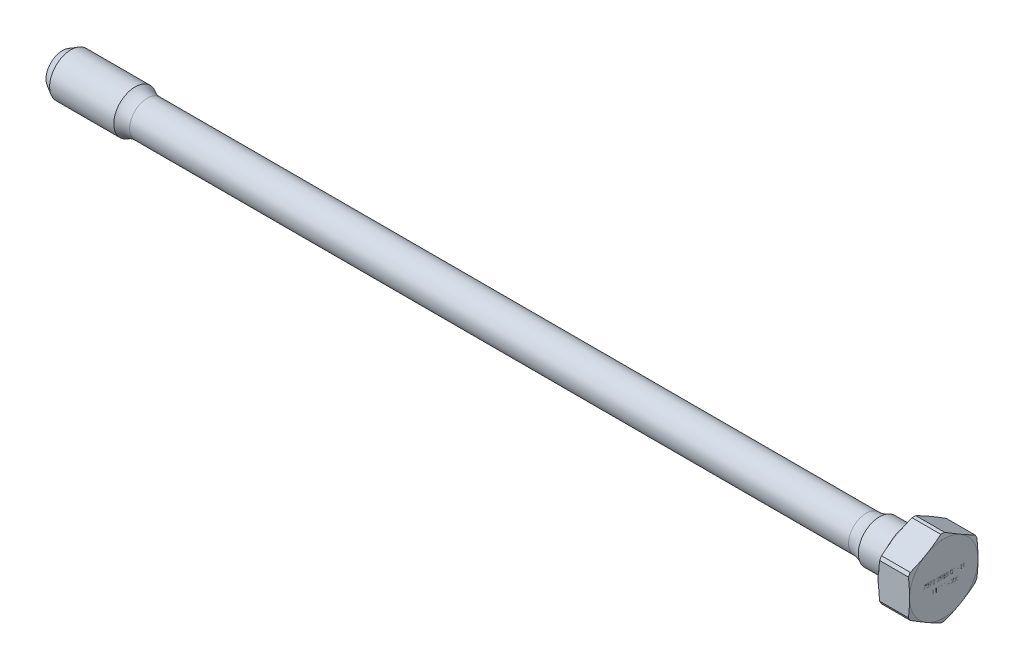
from build123d import *

# Parameters (mm, degrees)
CUT_EXTRUDE_THIN1_REACH = 414.786
SKETCH4_W               = 0.692307692
SKETCH4_H               = 0.184615385
CUT_EXTRUDE1_DEPTH      = 0.01


with BuildPart() as part:
    # Sketch1 → Revolve1 (revolve)
    with BuildSketch(Plane.XY):
        with BuildLine():
            Line((8, 0), (6.798278762, 2))
            Line((6.798278762, 2), (3.464101615, 2))
            Line((3.464101615, 2), (0, 4))
            Line((0, 4), (0, 7.690598923))
            Line((0, 7.690598923), (4, 10))
            Line((4, 10), (34, 10))
            ThreePointArc((34, 10), (36.693287386, 8.697513413), (39.651327278, 8.25))
            Line((39.651327278, 8.25), (375.706352409, 8.25))
            ThreePointArc((375.706352409, 8.25), (378.965953612, 8.682481614), (382, 9.95))
            Line((382, 9.95), (395, 9.95))
            ThreePointArc((395, 9.95), (396.414213562, 10.535786438), (397, 11.95))
            Line((397, 11.95), (397, 15.75))
            Line((397, 15.75), (397.5, 15.75))
            Line((397.5, 15.75), (397.5, 16))
            Line((397.5, 16), (398.035898385, 18))
            Line((398.035898385, 18), (411.464101615, 18))
            Line((411.464101615, 18), (412, 16))
            Line((412, 16), (412, 0))
            Line((412, 0), (8, 0))
        make_face()
    revolve(axis=Axis((412, 0, 0), (-1, 0, 0)))

    # Cut-Extrude-Thin1: up to this cone (the profile starts inside it)
    cut_extrude_thin1_end = Plane(origin=(412, 0, 0), z_dir=(1, 0, 0)).offset(-18.787186079) * Cone(3.732e-06, 1881.654948142, 504.187922789, align=(Align.CENTER, Align.CENTER, Align.MIN), mode=Mode.PRIVATE)
    # Sketch3 → Cut-Extrude-Thin1 (cut, up to the surface)
    with BuildSketch(Plane(origin=(412, 0, 0), x_dir=(0, 0, -1), z_dir=(1, 0, 0)), mode=Mode.PRIVATE) as cut_extrude_thin1_sk1:
        Polygon((0, 30.022213998), (-26, 15.011106999), (-26, -15.011106999), (0, -30.022213998), (26, -15.011106999), (26, 15.011106999), align=None)
        Polygon((0, 18.475208614), (-16, 9.237604307), (-16, -9.237604307), (0, -18.475208614), (16, -9.237604307), (16, 9.237604307), align=None, mode=Mode.SUBTRACT)
    cut_extrude_thin1_tool1 = extrude(cut_extrude_thin1_sk1.sketch, amount=-CUT_EXTRUDE_THIN1_REACH, mode=Mode.PRIVATE) & cut_extrude_thin1_end
    add(cut_extrude_thin1_tool1.solids().sort_by_distance((412, 21.828765, 12.602843))[0], mode=Mode.SUBTRACT)

    # Sketch4 → Cut-Extrude1 (cut)
    # profile 1 of 20: a face of its own
    with BuildSketch(Plane(origin=(412, 0, 0), x_dir=(0, 0, -1), z_dir=(-1, 0, 0))):
        Polygon((-9.32970633, -1.8), (-8.222014022, -1.8), (-9.168167868, 0.046153846), (-9.307711137, -0.030649038), (-8.495691907, -1.615384615), (-9.32970633, -1.615384615), align=None)
    # profile 2 of 20: a face of its own
    with BuildSketch(Plane(origin=(412, 0, 0), x_dir=(0, 0, -1), z_dir=(-1, 0, 0))):
        with BuildLine():
            Line((-7.82970633, -1.384615385), (-7.991244791, -1.384615385))
            add(Edge.make_bspline(
                [(-7.991244791, -1.384615385), (-7.986868451, -1.402734948), (-7.978313063, -1.438157212), (-7.960468597, -1.48876666), (-7.94102898, -1.536658757), (-7.917686012, -1.580936738), (-7.892224367, -1.622490459), (-7.863052682, -1.660377437), (-7.831516824, -1.695561248), (-7.796635422, -1.726785199), (-7.760054967, -1.75505946), (-7.72126002, -1.779166632), (-7.681031103, -1.799904768), (-7.639089492, -1.816989458), (-7.595310318, -1.829859728), (-7.550089369, -1.839197514), (-7.50330814, -1.845261515), (-7.471552236, -1.845853336), (-7.455427483, -1.846153846)],
                knots=[0, 0, 0, 0, 1.162005537, 2.271625781, 3.343758855, 4.383309926, 5.390229558, 6.379919256, 7.361854164, 8.333198761, 9.295911338, 10.242430842, 11.177959212, 12.116337295, 13.062827104, 14.020064771, 14.994644689, 16, 16, 16, 16], degree=3))
            add(Edge.make_bspline(
                [(-7.455427483, -1.846153846), (-7.431933502, -1.845444528), (-7.38545801, -1.844041363), (-7.317179872, -1.831228224), (-7.251337508, -1.810952442), (-7.188651609, -1.782937382), (-7.130424987, -1.748383907), (-7.078617805, -1.707259185), (-7.033932285, -1.660356687), (-6.996443748, -1.608551369), (-6.967090891, -1.553185678), (-6.945446471, -1.49620274), (-6.932269606, -1.437737726), (-6.930561891, -1.398262554), (-6.92970633, -1.378485577)],
                knots=[0, 0, 0, 0, 1.083050992, 2.142477498, 3.193116406, 4.255571735, 5.30263384, 6.308962982, 7.297363603, 8.282367274, 9.249857812, 10.179914175, 11.08814088, 12, 12, 12, 12], degree=3))
            add(Edge.make_bspline(
                [(-6.92970633, -1.378485577), (-6.930304748, -1.359453511), (-6.93147576, -1.322210712), (-6.941418808, -1.267839656), (-6.958151743, -1.216595404), (-6.981330478, -1.168262235), (-7.011334704, -1.123146603), (-7.047680663, -1.081147002), (-7.090624889, -1.04207715), (-7.123168342, -1.019695706), (-7.139922676, -1.008173077)],
                knots=[0, 0, 0, 0, 1.024540389, 2.004866551, 2.965041327, 3.920577974, 4.882998113, 5.874504559, 6.905732034, 8, 8, 8, 8], degree=3))
            add(Edge.make_bspline(
                [(-7.139922676, -1.008173077), (-7.12075051, -0.998960678), (-7.082703343, -0.980678671), (-7.031366612, -0.944255178), (-6.984053104, -0.903233283), (-6.957977388, -0.87086293), (-6.94485056, -0.854567308)],
                knots=[0, 0, 0, 0, 1.015663554, 2.015584519, 3.001021554, 4, 4, 4, 4], degree=3))
            add(Edge.make_bspline(
                [(-6.94485056, -0.854567308), (-6.936185773, -0.842710299), (-6.91899809, -0.819190449), (-6.897842752, -0.781353253), (-6.878431303, -0.743221934), (-6.864145038, -0.703297217), (-6.851816558, -0.662861556), (-6.843704829, -0.62104906), (-6.838497423, -0.578256985), (-6.837766197, -0.549294108), (-6.837398637, -0.534735577)],
                knots=[0, 0, 0, 0, 1.02516404, 2.033540309, 3.025129118, 4.011046665, 4.991655828, 5.976607087, 6.982917762, 8, 8, 8, 8], degree=3))
            add(Edge.make_bspline(
                [(-6.837398637, -0.534735577), (-6.838323695, -0.509531709), (-6.840169456, -0.459242583), (-6.856596222, -0.384924326), (-6.8822199, -0.312412067), (-6.917930742, -0.242734167), (-6.962313913, -0.177740147), (-7.014825242, -0.119420782), (-7.075520642, -0.069748369), (-7.142632925, -0.027877619), (-7.215623678, 0.005304479), (-7.293382827, 0.02921487), (-7.375449985, 0.043557751), (-7.431572003, 0.045278628), (-7.460114983, 0.046153846)],
                knots=[0, 0, 0, 0, 0.955619592, 1.906742024, 2.874954321, 3.868585453, 4.869520953, 5.854611167, 6.836527075, 7.836578462, 8.849204403, 9.870874567, 10.917152508, 12, 12, 12, 12], degree=3))
            add(Edge.make_bspline(
                [(-7.460114983, 0.046153846), (-7.479357984, 0.045703442), (-7.517221791, 0.044817197), (-7.572907128, 0.038866523), (-7.625948748, 0.027702625), (-7.676861708, 0.013662478), (-7.724877606, -0.005749598), (-7.770687107, -0.02889239), (-7.814089411, -0.056359362), (-7.854826767, -0.088196708), (-7.892855652, -0.123833855), (-7.927207215, -0.163862837), (-7.958261521, -0.207536574), (-7.985821254, -0.255247918), (-8.010002403, -0.306863238), (-8.030284587, -0.362589364), (-8.047993439, -0.421994283), (-8.056242957, -0.463380989), (-8.06047556, -0.484615385)],
                knots=[0, 0, 0, 0, 1.048603596, 2.063302207, 3.045874044, 3.999447474, 4.937100059, 5.862643889, 6.7929026, 7.7308982, 8.676022965, 9.627908155, 10.600123445, 11.591992905, 12.626222643, 13.701663232, 14.820785756, 16, 16, 16, 16], degree=3))
            Line((-8.06047556, -0.484615385), (-7.898937099, -0.484615385))
            add(Edge.make_bspline(
                [(-7.898937099, -0.484615385), (-7.894728549, -0.470755892), (-7.886542554, -0.443797975), (-7.872608343, -0.405000104), (-7.856733232, -0.369433105), (-7.839702888, -0.336836071), (-7.82181683, -0.306887978), (-7.80180344, -0.280380731), (-7.781145022, -0.256150056), (-7.765572783, -0.242498541), (-7.757951522, -0.235817308)],
                knots=[0, 0, 0, 0, 1.198163088, 2.33053128, 3.407730985, 4.417276592, 5.372219308, 6.28897303, 7.162600585, 8, 8, 8, 8], degree=3))
            add(Edge.make_bspline(
                [(-7.757951522, -0.235817308), (-7.747872157, -0.228050511), (-7.72774454, -0.212540893), (-7.694966343, -0.192691971), (-7.660373111, -0.175701768), (-7.623676359, -0.161891419), (-7.584871166, -0.151524873), (-7.54411494, -0.144063521), (-7.501340813, -0.139137869), (-7.472148306, -0.13869027), (-7.457230368, -0.138461538)],
                knots=[0, 0, 0, 0, 0.946083416, 1.889246487, 2.84504177, 3.809995578, 4.801312957, 5.829064617, 6.89060985, 8, 8, 8, 8], degree=3))
            add(Edge.make_bspline(
                [(-7.457230368, -0.138461538), (-7.440385482, -0.138777775), (-7.40744676, -0.139396147), (-7.359387447, -0.145099422), (-7.313652234, -0.153369348), (-7.27070785, -0.16630512), (-7.229969927, -0.181823716), (-7.192347853, -0.202140407), (-7.156735586, -0.225084824), (-7.1241764, -0.251773594), (-7.094822702, -0.280621266), (-7.069457863, -0.311226074), (-7.047489012, -0.342639072), (-7.029829722, -0.37559306), (-7.015860395, -0.409764787), (-7.006356401, -0.445282157), (-6.99974661, -0.481846093), (-6.999208412, -0.506701041), (-6.998937099, -0.519230769)],
                knots=[0, 0, 0, 0, 1.216990249, 2.379719373, 3.493992396, 4.571561497, 5.616923107, 6.638958652, 7.655775068, 8.674704564, 9.676001865, 10.625896028, 11.54399481, 12.441854662, 13.322657739, 14.20572845, 15.095482574, 16, 16, 16, 16], degree=3))
            add(Edge.make_bspline(
                [(-6.998937099, -0.519230769), (-6.999725753, -0.536001261), (-7.001299138, -0.569458797), (-7.013261811, -0.618700762), (-7.033114676, -0.666163542), (-7.060367437, -0.711225572), (-7.094337531, -0.752500767), (-7.133419192, -0.789446516), (-7.1784463, -0.820209536), (-7.220123847, -0.841404855), (-7.257136426, -0.855526459), (-7.288747047, -0.865428966), (-7.324167731, -0.873344661), (-7.362972872, -0.88100159), (-7.40532625, -0.887420655), (-7.451265986, -0.892796879), (-7.500810574, -0.897091944), (-7.535108819, -0.899011053), (-7.552783253, -0.9)],
                knots=[0, 0, 0, 0, 1.070440979, 2.135555593, 3.216243406, 4.345886539, 5.486149072, 6.621334998, 7.769144672, 8.957074012, 9.598644492, 10.297969361, 11.070758978, 11.915404831, 12.824182859, 13.805940418, 14.869366021, 16, 16, 16, 16], degree=3))
            Line((-7.552783253, -0.9), (-7.552783253, -1.084615385))
            add(Edge.make_bspline(
                [(-7.552783253, -1.084615385), (-7.530522743, -1.085049391), (-7.48693512, -1.085899206), (-7.423085767, -1.094060967), (-7.36221738, -1.107308659), (-7.305245511, -1.125804157), (-7.253586286, -1.148320964), (-7.208340136, -1.173531186), (-7.1711348, -1.20261518), (-7.141303929, -1.234198105), (-7.119178047, -1.268286621), (-7.102846029, -1.303654314), (-7.093185984, -1.340959147), (-7.091894134, -1.366412644), (-7.091244791, -1.379206731)],
                knots=[0, 0, 0, 0, 1.321816535, 2.58820849, 3.816448615, 5.017641336, 6.139869627, 7.160068286, 8.085608132, 8.934319198, 9.728416342, 10.48890201, 11.240453369, 12, 12, 12, 12], degree=3))
            add(Edge.make_bspline(
                [(-7.091244791, -1.379206731), (-7.091453228, -1.388608301), (-7.091867902, -1.407312278), (-7.097306347, -1.434723705), (-7.105101038, -1.461297531), (-7.116425146, -1.486723259), (-7.131070659, -1.511081715), (-7.14878955, -1.534461865), (-7.169626702, -1.557086967), (-7.193446803, -1.578458027), (-7.220030646, -1.597692359), (-7.248311259, -1.614839498), (-7.278398897, -1.629257801), (-7.310097487, -1.641209595), (-7.343578376, -1.650184395), (-7.378665427, -1.656632593), (-7.415430769, -1.660663055), (-7.44051334, -1.661243429), (-7.453264022, -1.661538462)],
                knots=[0, 0, 0, 0, 0.884246871, 1.759167212, 2.622361933, 3.489113179, 4.372562419, 5.294145153, 6.247651513, 7.265905295, 8.30305477, 9.334068495, 10.37719476, 11.441246459, 12.52060732, 13.637552802, 14.799054011, 16, 16, 16, 16], degree=3))
            add(Edge.make_bspline(
                [(-7.453264022, -1.661538462), (-7.473759843, -1.660824292), (-7.513792948, -1.659429353), (-7.57149404, -1.647168464), (-7.625079643, -1.627742351), (-7.665901063, -1.604285376), (-7.696096189, -1.581209997), (-7.718087031, -1.561358249), (-7.739288456, -1.538850432), (-7.7588685, -1.513069183), (-7.778000441, -1.484901015), (-7.796501597, -1.454190787), (-7.813777711, -1.420500664), (-7.824293964, -1.396808798), (-7.82970633, -1.384615385)],
                knots=[0, 0, 0, 0, 1.4727372, 2.876598283, 4.222346151, 5.558423782, 6.24313385, 6.953189256, 7.68715613, 8.463578749, 9.278833271, 10.135787152, 11.040551781, 12, 12, 12, 12], degree=3))
        make_face()
    # profile 3 of 20: a face of its own
    with BuildSketch(Plane(origin=(412, 0, 0), x_dir=(0, 0, -1), z_dir=(-1, 0, 0))):
        Polygon((-6.56047556, -1.8), (-5.452783253, -1.8), (-6.398937099, 0.046153846), (-6.538480368, -0.030649038), (-5.726461137, -1.615384615), (-6.56047556, -1.615384615), align=None)
    # profile 4 of 20: a face of its own
    with BuildSketch(Plane(origin=(412, 0, 0), x_dir=(0, 0, -1), z_dir=(-1, 0, 0))):
        with BuildLine():
            Line((-5.06047556, -1.246153846), (-5.222014022, -1.246153846))
            add(Edge.make_bspline(
                [(-5.222014022, -1.246153846), (-5.22096138, -1.267584694), (-5.218894018, -1.309674309), (-5.209208362, -1.371039395), (-5.195362231, -1.429701558), (-5.175739033, -1.48515788), (-5.151506099, -1.538070831), (-5.121837975, -1.58773779), (-5.087367137, -1.634651694), (-5.048156823, -1.677924309), (-5.005610019, -1.717480889), (-4.959981646, -1.752001503), (-4.911740677, -1.780834341), (-4.861305535, -1.805069006), (-4.808092921, -1.823237977), (-4.752611489, -1.836724977), (-4.694610468, -1.844838094), (-4.655092787, -1.845710272), (-4.634994791, -1.846153846)],
                knots=[0, 0, 0, 0, 1.100776268, 2.161895295, 3.184016182, 4.190939212, 5.176500551, 6.166955529, 7.155448256, 8.160289653, 9.16017456, 10.133824356, 11.091467644, 12.04088621, 13.000931625, 13.972173743, 14.968683325, 16, 16, 16, 16], degree=3))
            add(Edge.make_bspline(
                [(-4.634994791, -1.846153846), (-4.615256107, -1.845695533), (-4.576470298, -1.844794963), (-4.519886625, -1.836944817), (-4.465892231, -1.824915168), (-4.415099034, -1.807089124), (-4.366985752, -1.784721338), (-4.322148108, -1.756904065), (-4.27950188, -1.724953525), (-4.241140072, -1.687266297), (-4.205900124, -1.64705393), (-4.175525418, -1.604107459), (-4.149366483, -1.559699486), (-4.127956212, -1.51348312), (-4.111726274, -1.465307858), (-4.099701446, -1.415635572), (-4.092827404, -1.363893011), (-4.091778209, -1.328865775), (-4.091244791, -1.311057692)],
                knots=[0, 0, 0, 0, 1.111674182, 2.184400057, 3.212814286, 4.223731311, 5.211378316, 6.196328225, 7.191884489, 8.207283132, 9.220262353, 10.201199469, 11.166417575, 12.120932471, 13.06540007, 14.026332106, 14.996573967, 16, 16, 16, 16], degree=3))
            add(Edge.make_bspline(
                [(-4.091244791, -1.311057692), (-4.092117102, -1.285987963), (-4.093846417, -1.236288443), (-4.108591968, -1.163243641), (-4.131722768, -1.092563643), (-4.15923882, -1.035458466), (-4.186892336, -0.989394593), (-4.212465652, -0.951822035), (-4.242001176, -0.911145427), (-4.275933882, -0.867408528), (-4.314776321, -0.821169673), (-4.35704678, -0.771186594), (-4.40461038, -0.719039074), (-4.437845368, -0.683380978), (-4.455066907, -0.664903846)],
                knots=[0, 0, 0, 0, 1.184219417, 2.34765746, 3.508456027, 4.692825395, 5.335023057, 6.047372803, 6.840716919, 7.711366838, 8.663720231, 9.695456184, 10.805843131, 12, 12, 12, 12], degree=3))
            Line((-4.455066907, -0.664903846), (-4.905427483, -0.184615385))
            Line((-4.905427483, -0.184615385), (-4.068167868, -0.184615385))
            Line((-4.068167868, -0.184615385), (-4.068167868, 0))
            Line((-4.068167868, 0), (-5.291244791, 0))
            Line((-5.291244791, 0), (-4.593167868, -0.744951923))
            add(Edge.make_bspline(
                [(-4.593167868, -0.744951923), (-4.576170609, -0.762692942), (-4.543522352, -0.796769807), (-4.497364287, -0.846536061), (-4.455840236, -0.892650691), (-4.418922655, -0.935318042), (-4.386581169, -0.97429623), (-4.358919255, -1.009890718), (-4.335814653, -1.041796045), (-4.311328589, -1.079277089), (-4.287979502, -1.125093533), (-4.267458044, -1.180801987), (-4.255034633, -1.238276292), (-4.253536717, -1.277103964), (-4.252783253, -1.296634615)],
                knots=[0, 0, 0, 0, 1.329530082, 2.553755191, 3.672934919, 4.687409497, 5.60679272, 6.413407421, 7.126401618, 7.737995624, 8.834647426, 9.90044882, 10.943907757, 12, 12, 12, 12], degree=3))
            add(Edge.make_bspline(
                [(-4.252783253, -1.296634615), (-4.253106847, -1.308917835), (-4.253744591, -1.333125701), (-4.259479594, -1.368594904), (-4.267905453, -1.402941748), (-4.280892304, -1.43574156), (-4.296495527, -1.467639448), (-4.316429795, -1.497665618), (-4.339209429, -1.526843589), (-4.365632687, -1.554172872), (-4.394640515, -1.57921074), (-4.425289982, -1.601388366), (-4.45771549, -1.61992289), (-4.491781908, -1.635116655), (-4.527393845, -1.647035431), (-4.56462029, -1.655294127), (-4.603358354, -1.660479405), (-4.629809867, -1.661180979), (-4.64328806, -1.661538462)],
                knots=[0, 0, 0, 0, 0.991504627, 1.954065223, 2.895985987, 3.842598665, 4.797835564, 5.759220273, 6.74786863, 7.784730864, 8.824135544, 9.839918996, 10.835834653, 11.835434876, 12.84861661, 13.863796685, 14.911511676, 16, 16, 16, 16], degree=3))
            add(Edge.make_bspline(
                [(-4.64328806, -1.661538462), (-4.657368084, -1.661185352), (-4.685018927, -1.660491904), (-4.725529246, -1.65523614), (-4.764445256, -1.647276553), (-4.801167273, -1.634604956), (-4.836463824, -1.619774507), (-4.869434475, -1.600571685), (-4.901005414, -1.57862949), (-4.930541896, -1.553046285), (-4.957443249, -1.5241667), (-4.981915651, -1.492731782), (-5.00265136, -1.458184254), (-5.021058239, -1.421353093), (-5.035135868, -1.381226396), (-5.047171231, -1.338785509), (-5.055913545, -1.293424902), (-5.058929632, -1.262172573), (-5.06047556, -1.246153846)],
                knots=[0, 0, 0, 0, 1.031072318, 2.024855787, 2.988461151, 3.935103592, 4.865765533, 5.788564469, 6.724086513, 7.67908574, 8.64457978, 9.611397706, 10.591395687, 11.591555111, 12.622101007, 13.700900657, 14.821571223, 16, 16, 16, 16], degree=3))
        make_face()
    # profile 5 of 20: a face of its own
    with BuildSketch(Plane(origin=(412, 0, 0), x_dir=(0, 0, -1), z_dir=(-1, 0, 0))):
        with BuildLine():
            Line((-2.983552483, -1.246153846), (-3.145090945, -1.246153846))
            add(Edge.make_bspline(
                [(-3.145090945, -1.246153846), (-3.144038303, -1.267584694), (-3.141970941, -1.309674309), (-3.132285285, -1.371039395), (-3.118439154, -1.429701558), (-3.098815957, -1.48515788), (-3.074583022, -1.538070831), (-3.044914898, -1.58773779), (-3.01044406, -1.634651694), (-2.971233746, -1.677924309), (-2.928686942, -1.717480889), (-2.883058569, -1.752001503), (-2.8348176, -1.780834341), (-2.784382458, -1.805069006), (-2.731169844, -1.823237977), (-2.675688412, -1.836724977), (-2.617687391, -1.844838094), (-2.57816971, -1.845710272), (-2.558071714, -1.846153846)],
                knots=[0, 0, 0, 0, 1.100776268, 2.161895295, 3.184016182, 4.190939212, 5.176500551, 6.166955529, 7.155448256, 8.160289653, 9.16017456, 10.133824356, 11.091467644, 12.04088621, 13.000931625, 13.972173743, 14.968683325, 16, 16, 16, 16], degree=3))
            add(Edge.make_bspline(
                [(-2.558071714, -1.846153846), (-2.53833303, -1.845695533), (-2.499547221, -1.844794963), (-2.442963548, -1.836944817), (-2.388969154, -1.824915168), (-2.338175957, -1.807089124), (-2.290062675, -1.784721338), (-2.245225031, -1.756904065), (-2.202578803, -1.724953525), (-2.164216995, -1.687266297), (-2.128977047, -1.64705393), (-2.098602341, -1.604107459), (-2.072443406, -1.559699486), (-2.051033135, -1.51348312), (-2.034803198, -1.465307858), (-2.022778369, -1.415635572), (-2.015904327, -1.363893011), (-2.014855132, -1.328865775), (-2.014321714, -1.311057692)],
                knots=[0, 0, 0, 0, 1.111674182, 2.184400057, 3.212814286, 4.223731311, 5.211378316, 6.196328225, 7.191884489, 8.207283132, 9.220262353, 10.201199469, 11.166417575, 12.120932471, 13.06540007, 14.026332106, 14.996573967, 16, 16, 16, 16], degree=3))
            add(Edge.make_bspline(
                [(-2.014321714, -1.311057692), (-2.015194025, -1.285987963), (-2.01692334, -1.236288443), (-2.031668891, -1.163243641), (-2.054799691, -1.092563643), (-2.082315743, -1.035458466), (-2.109969259, -0.989394593), (-2.135542575, -0.951822035), (-2.165078099, -0.911145427), (-2.199010805, -0.867408528), (-2.237853244, -0.821169673), (-2.280123703, -0.771186594), (-2.327687303, -0.719039074), (-2.360922291, -0.683380978), (-2.37814383, -0.664903846)],
                knots=[0, 0, 0, 0, 1.184219417, 2.34765746, 3.508456027, 4.692825395, 5.335023057, 6.047372803, 6.840716919, 7.711366838, 8.663720231, 9.695456184, 10.805843131, 12, 12, 12, 12], degree=3))
            Line((-2.37814383, -0.664903846), (-2.828504407, -0.184615385))
            Line((-2.828504407, -0.184615385), (-1.991244791, -0.184615385))
            Line((-1.991244791, -0.184615385), (-1.991244791, 0))
            Line((-1.991244791, 0), (-3.214321714, 0))
            Line((-3.214321714, 0), (-2.516244791, -0.744951923))
            add(Edge.make_bspline(
                [(-2.516244791, -0.744951923), (-2.499247532, -0.762692942), (-2.466599275, -0.796769807), (-2.42044121, -0.846536061), (-2.378917159, -0.892650691), (-2.341999579, -0.935318042), (-2.309658092, -0.97429623), (-2.281996178, -1.009890718), (-2.258891576, -1.041796045), (-2.234405512, -1.079277089), (-2.211056425, -1.125093533), (-2.190534968, -1.180801987), (-2.178111556, -1.238276292), (-2.17661364, -1.277103964), (-2.175860176, -1.296634615)],
                knots=[0, 0, 0, 0, 1.329530082, 2.553755191, 3.672934919, 4.687409497, 5.60679272, 6.413407421, 7.126401618, 7.737995624, 8.834647426, 9.90044882, 10.943907757, 12, 12, 12, 12], degree=3))
            add(Edge.make_bspline(
                [(-2.175860176, -1.296634615), (-2.176183771, -1.308917835), (-2.176821514, -1.333125701), (-2.182556517, -1.368594904), (-2.190982376, -1.402941748), (-2.203969227, -1.43574156), (-2.21957245, -1.467639448), (-2.239506718, -1.497665618), (-2.262286352, -1.526843589), (-2.288709611, -1.554172872), (-2.317717438, -1.57921074), (-2.348366905, -1.601388366), (-2.380792413, -1.61992289), (-2.414858831, -1.635116655), (-2.450470768, -1.647035431), (-2.487697213, -1.655294127), (-2.526435277, -1.660479405), (-2.55288679, -1.661180979), (-2.566364983, -1.661538462)],
                knots=[0, 0, 0, 0, 0.991504627, 1.954065223, 2.895985987, 3.842598665, 4.797835564, 5.759220273, 6.74786863, 7.784730864, 8.824135544, 9.839918996, 10.835834653, 11.835434876, 12.84861661, 13.863796685, 14.911511676, 16, 16, 16, 16], degree=3))
            add(Edge.make_bspline(
                [(-2.566364983, -1.661538462), (-2.580445007, -1.661185352), (-2.60809585, -1.660491904), (-2.648606169, -1.65523614), (-2.687522179, -1.647276553), (-2.724244196, -1.634604956), (-2.759540747, -1.619774507), (-2.792511398, -1.600571685), (-2.824082337, -1.57862949), (-2.853618819, -1.553046285), (-2.880520172, -1.5241667), (-2.904992574, -1.492731782), (-2.925728283, -1.458184254), (-2.944135162, -1.421353093), (-2.958212791, -1.381226396), (-2.970248155, -1.338785509), (-2.978990468, -1.293424902), (-2.982006555, -1.262172573), (-2.983552483, -1.246153846)],
                knots=[0, 0, 0, 0, 1.031072318, 2.024855787, 2.988461151, 3.935103592, 4.865765533, 5.788564469, 6.724086513, 7.67908574, 8.64457978, 9.611397706, 10.591395687, 11.591555111, 12.622101007, 13.700900657, 14.821571223, 16, 16, 16, 16], degree=3))
        make_face()
    # profile 6 of 20: a face of its own
    with BuildSketch(Plane(origin=(412, 0, 0), x_dir=(0, 0, -1), z_dir=(-1, 0, 0))):
        with BuildLine():
            Line((-1.437398637, 0.046153846), (-1.566485176, -0.043629808))
            Line((-1.566485176, -0.043629808), (-1.066004407, -0.775240385))
            add(Edge.make_bspline(
                [(-1.066004407, -0.775240385), (-1.09793237, -0.771153166), (-1.160783618, -0.763107343), (-1.224136969, -0.762055819), (-1.255307291, -0.761538462)],
                knots=[0, 0, 0, 0, 1.015985029, 2, 2, 2, 2], degree=3))
            add(Edge.make_bspline(
                [(-1.255307291, -0.761538462), (-1.274202679, -0.762023879), (-1.311292672, -0.762976711), (-1.365830671, -0.770486371), (-1.418312822, -0.782183545), (-1.468539233, -0.799232971), (-1.516465114, -0.821022604), (-1.562257879, -0.847565152), (-1.605856235, -0.878959722), (-1.646749663, -0.914867688), (-1.683932106, -0.954306275), (-1.717085264, -0.996033311), (-1.74448788, -1.040501542), (-1.767657677, -1.086772527), (-1.784736529, -1.135834029), (-1.797473965, -1.186853523), (-1.80522998, -1.240147719), (-1.806158144, -1.276416658), (-1.806629407, -1.294831731)],
                knots=[0, 0, 0, 0, 1.060682839, 2.082027659, 3.085691555, 4.076014095, 5.054630121, 6.037449673, 7.043289733, 8.066773124, 9.088474683, 10.083546559, 11.053653938, 12.01652662, 12.983553501, 13.964076119, 14.966286614, 16, 16, 16, 16], degree=3))
            add(Edge.make_bspline(
                [(-1.806629407, -1.294831731), (-1.805735619, -1.320014638), (-1.803981295, -1.369443577), (-1.789916142, -1.441680476), (-1.76661278, -1.510021357), (-1.734630125, -1.5743898), (-1.693574589, -1.633307262), (-1.644818097, -1.686574127), (-1.587966586, -1.733240192), (-1.524504355, -1.773308501), (-1.45601339, -1.80575337), (-1.383984537, -1.828804067), (-1.309631166, -1.843529391), (-1.259101366, -1.845275255), (-1.233672676, -1.846153846)],
                knots=[0, 0, 0, 0, 1.023011052, 2.007963168, 2.978169221, 3.950402619, 4.919353283, 5.887490769, 6.876420893, 7.899700203, 8.931203047, 9.947778163, 10.96723692, 12, 12, 12, 12], degree=3))
            add(Edge.make_bspline(
                [(-1.233672676, -1.846153846), (-1.208734811, -1.845215997), (-1.15945994, -1.843362894), (-1.086904085, -1.829672294), (-1.017350207, -1.806843717), (-0.951342832, -1.775152568), (-0.890550864, -1.735165766), (-0.835645984, -1.687930006), (-0.788303075, -1.632902895), (-0.747925904, -1.571770237), (-0.716121528, -1.505675253), (-0.692816107, -1.436817008), (-0.67857054, -1.365607557), (-0.676769244, -1.31737207), (-0.675860176, -1.293028846)],
                knots=[0, 0, 0, 0, 1.026310256, 2.027892329, 3.027798401, 4.032590076, 5.033095916, 6.015299856, 7.004484051, 8.011843335, 9.023241558, 10.015317641, 10.998381257, 12, 12, 12, 12], degree=3))
            add(Edge.make_bspline(
                [(-0.675860176, -1.293028846), (-0.67646136, -1.274131201), (-0.677680711, -1.235802056), (-0.686343256, -1.177726419), (-0.700594462, -1.118433843), (-0.716868911, -1.068137572), (-0.73378425, -1.026889426), (-0.747912723, -0.993693125), (-0.765140256, -0.959286833), (-0.784746079, -0.923421742), (-0.805765141, -0.885575417), (-0.829459561, -0.846451752), (-0.855329055, -0.805829586), (-0.873756042, -0.778445554), (-0.883191907, -0.764423077)],
                knots=[0, 0, 0, 0, 1.179744101, 2.39281581, 3.657884751, 4.98449437, 5.688244212, 6.441097573, 7.23650985, 8.089392143, 8.993247458, 9.939208743, 10.944735416, 12, 12, 12, 12], degree=3))
            Line((-0.883191907, -0.764423077), (-1.437398637, 0.046153846))
        make_face()
        with BuildLine():
            add(Edge.make_bspline(
                [(-1.225379407, -0.946153846), (-1.211065114, -0.946545711), (-1.183200054, -0.947308538), (-1.142372676, -0.951930626), (-1.103857393, -0.960186275), (-1.067406317, -0.971844403), (-1.033063577, -0.986612925), (-1.000818356, -1.004610786), (-0.971000023, -1.026232281), (-0.943502421, -1.050535275), (-0.918547511, -1.077170391), (-0.897030626, -1.105707444), (-0.878400899, -1.135259887), (-0.863538541, -1.166432701), (-0.851561002, -1.198715934), (-0.843203494, -1.232576466), (-0.838587527, -1.267780508), (-0.837799234, -1.291693827), (-0.837398637, -1.303846154)],
                knots=[0, 0, 0, 0, 1.163726718, 2.265380301, 3.334713825, 4.36057981, 5.371541381, 6.368955992, 7.355979581, 8.359691305, 9.348261197, 10.317521986, 11.261029684, 12.183096459, 13.119698615, 14.055740009, 15.011961376, 16, 16, 16, 16], degree=3))
            add(Edge.make_bspline(
                [(-0.837398637, -1.303846154), (-0.837742674, -1.316003889), (-0.838420639, -1.339962198), (-0.843870782, -1.375213573), (-0.853429945, -1.409009015), (-0.866394343, -1.441569956), (-0.883117173, -1.472750864), (-0.903454544, -1.502461306), (-0.927537922, -1.53081058), (-0.954979797, -1.557443479), (-0.98509243, -1.581916363), (-1.017281877, -1.603154932), (-1.050842403, -1.621410256), (-1.086155367, -1.635702372), (-1.122741515, -1.647434514), (-1.161003244, -1.655734044), (-1.200986993, -1.660359229), (-1.22813231, -1.661140377), (-1.241965945, -1.661538462)],
                knots=[0, 0, 0, 0, 0.97180342, 1.915057841, 2.843062057, 3.774592458, 4.711855407, 5.666109401, 6.64802866, 7.681008178, 8.719604906, 9.745767187, 10.760480799, 11.768803314, 12.78696958, 13.829338598, 14.893800474, 16, 16, 16, 16], degree=3))
            add(Edge.make_bspline(
                [(-1.241965945, -1.661538462), (-1.255679303, -1.661139797), (-1.282584799, -1.660357619), (-1.322212615, -1.655742103), (-1.3602174, -1.647381136), (-1.396690639, -1.6356966), (-1.431929121, -1.621489815), (-1.465222497, -1.603155361), (-1.497076544, -1.581802986), (-1.527180474, -1.557475002), (-1.554562279, -1.530682552), (-1.579062968, -1.502587621), (-1.599353761, -1.472734857), (-1.616100165, -1.441574184), (-1.629058328, -1.409007891), (-1.638619156, -1.375213877), (-1.644068851, -1.339962119), (-1.644746878, -1.316003863), (-1.645090945, -1.303846154)],
                knots=[0, 0, 0, 0, 1.099260809, 2.156740654, 3.192227907, 4.212865946, 5.223636336, 6.232338816, 7.252976855, 8.294094955, 9.329582207, 10.320135147, 11.276705756, 12.216244072, 13.150035923, 14.080293028, 15.025837361, 16, 16, 16, 16], degree=3))
            add(Edge.make_bspline(
                [(-1.645090945, -1.303846154), (-1.644778987, -1.2916844), (-1.64416375, -1.267699195), (-1.638240048, -1.232454504), (-1.628307323, -1.198681498), (-1.615136477, -1.166091878), (-1.597460822, -1.13510727), (-1.57597979, -1.105567004), (-1.551194345, -1.076867169), (-1.522292214, -1.050618556), (-1.491256323, -1.026115962), (-1.457920471, -1.004746733), (-1.422954559, -0.986827977), (-1.386583092, -0.971800869), (-1.348533914, -0.960303872), (-1.308860009, -0.951945961), (-1.26755423, -0.947352851), (-1.239572557, -0.946557349), (-1.225379407, -0.946153846)],
                knots=[0, 0, 0, 0, 0.952872936, 1.879239831, 2.791748947, 3.708674669, 4.628500839, 5.580394867, 6.568761142, 7.595635223, 8.636123962, 9.665976811, 10.694276597, 11.712685318, 12.747011694, 13.805940053, 14.887106426, 16, 16, 16, 16], degree=3))
        make_face(mode=Mode.SUBTRACT)
    # profile 7 of 20: a face of its own
    with BuildSketch(Plane(origin=(412, 0, 0), x_dir=(0, 0, -1), z_dir=(-1, 0, 0))):
        with BuildLine():
            add(Edge.make_bspline(
                [(0.430029247, -1.002764423), (0.444645509, -0.995083435), (0.47324127, -0.980056083), (0.513977013, -0.955786441), (0.551997364, -0.931092929), (0.586599112, -0.905087716), (0.618121492, -0.878323581), (0.646661512, -0.850871346), (0.6725261, -0.822817829), (0.694826696, -0.793441829), (0.714613059, -0.763265738), (0.731374535, -0.73191764), (0.746003048, -0.699850523), (0.757484607, -0.666577542), (0.76696395, -0.632555155), (0.773481403, -0.597326838), (0.776987632, -0.561129388), (0.777650397, -0.536665662), (0.777985978, -0.524278846)],
                knots=[0, 0, 0, 0, 1.264219729, 2.473363326, 3.62979159, 4.734286947, 5.785533755, 6.79450939, 7.765315851, 8.704182021, 9.615576613, 10.525715488, 11.423813905, 12.311666436, 13.218214638, 14.126256791, 15.051260205, 16, 16, 16, 16], degree=3))
            add(Edge.make_bspline(
                [(0.777985978, -0.524278846), (0.777591471, -0.506947837), (0.776810594, -0.472643267), (0.769938273, -0.422024695), (0.759786946, -0.372664714), (0.744366108, -0.325122876), (0.725390034, -0.278994116), (0.701444738, -0.234899911), (0.674419371, -0.191574521), (0.652685296, -0.164926267), (0.641687901, -0.151442308)],
                knots=[0, 0, 0, 0, 1.02531512, 2.029483338, 3.018748588, 4.004195107, 4.983200899, 5.966616707, 6.971112471, 8, 8, 8, 8], degree=3))
            add(Edge.make_bspline(
                [(0.641687901, -0.151442308), (0.627372, -0.135708367), (0.598917103, -0.104434913), (0.550171598, -0.06383164), (0.496674629, -0.029709094), (0.438633201, -0.001900691), (0.376202463, 0.019743465), (0.309395718, 0.03529676), (0.238082725, 0.044205438), (0.189068483, 0.045493204), (0.163923478, 0.046153846)],
                knots=[0, 0, 0, 0, 0.954267603, 1.896743057, 2.838368354, 3.796610408, 4.779680527, 5.799409237, 6.871065594, 8, 8, 8, 8], degree=3))
            add(Edge.make_bspline(
                [(0.163923478, 0.046153846), (0.139745721, 0.045559553), (0.092698261, 0.044403118), (0.024209401, 0.036610737), (-0.039710482, 0.022815243), (-0.099364447, 0.004323735), (-0.154175657, -0.020335131), (-0.204243771, -0.050559702), (-0.250302627, -0.085667608), (-0.290907303, -0.126503758), (-0.326946192, -0.170251732), (-0.358631446, -0.215371227), (-0.384819209, -0.261829401), (-0.407390958, -0.308919579), (-0.424188719, -0.357595908), (-0.436102801, -0.407358856), (-0.443586506, -0.458067053), (-0.444587414, -0.492282353), (-0.445090945, -0.509495192)],
                knots=[0, 0, 0, 0, 1.256864279, 2.445730223, 3.576845088, 4.651810441, 5.686528262, 6.692706664, 7.686234615, 8.689148594, 9.678739427, 10.630299996, 11.55097961, 12.448208961, 13.341360817, 14.221834469, 15.105450545, 16, 16, 16, 16], degree=3))
            add(Edge.make_bspline(
                [(-0.445090945, -0.509495192), (-0.444793676, -0.522125606), (-0.444206168, -0.54708776), (-0.44014187, -0.583967254), (-0.433602191, -0.619860886), (-0.424740324, -0.654910331), (-0.412620173, -0.688930652), (-0.39824135, -0.722097296), (-0.381314025, -0.754409302), (-0.361171645, -0.785374728), (-0.338979965, -0.816090445), (-0.312636399, -0.845031275), (-0.283897258, -0.873897164), (-0.251051691, -0.900932778), (-0.215873601, -0.92837164), (-0.176722363, -0.953920345), (-0.134903441, -0.979572846), (-0.105173522, -0.994901258), (-0.089922676, -1.002764423)],
                knots=[0, 0, 0, 0, 0.941575622, 1.860885767, 2.762557628, 3.660168386, 4.552890429, 5.45184204, 6.353736508, 7.268493418, 8.204037487, 9.175167802, 10.182660057, 11.238220596, 12.344046335, 13.507168087, 14.721227736, 16, 16, 16, 16], degree=3))
            add(Edge.make_bspline(
                [(-0.089922676, -1.002764423), (-0.110772825, -1.014181083), (-0.151081421, -1.036252366), (-0.204964257, -1.07629761), (-0.250607576, -1.120454945), (-0.287526311, -1.16879082), (-0.316675522, -1.219716604), (-0.337284346, -1.272964201), (-0.350736197, -1.327939721), (-0.352098882, -1.365427568), (-0.352783253, -1.384254808)],
                knots=[0, 0, 0, 0, 1.16701039, 2.256125286, 3.287752239, 4.277689688, 5.235169525, 6.160862735, 7.076343936, 8, 8, 8, 8], degree=3))
            add(Edge.make_bspline(
                [(-0.352783253, -1.384254808), (-0.351940686, -1.403435524), (-0.350246979, -1.441992109), (-0.336598527, -1.499403172), (-0.314188491, -1.55582094), (-0.284229607, -1.611114672), (-0.246103226, -1.662764853), (-0.200975325, -1.709464051), (-0.148902672, -1.750003643), (-0.091029806, -1.784272923), (-0.028861782, -1.812297636), (0.036841653, -1.831429687), (0.104909503, -1.844012853), (0.151246339, -1.845433518), (0.174740786, -1.846153846)],
                knots=[0, 0, 0, 0, 0.888724595, 1.786491426, 2.720083884, 3.697804067, 4.69440576, 5.687697823, 6.7000873, 7.744853364, 8.800284131, 9.853047784, 10.91141782, 12, 12, 12, 12], degree=3))
            add(Edge.make_bspline(
                [(0.174740786, -1.846153846), (0.197629316, -1.845413226), (0.242762891, -1.843952809), (0.309203685, -1.831652226), (0.372829475, -1.811338567), (0.433283662, -1.78367129), (0.489279913, -1.749197053), (0.539111392, -1.708211327), (0.583184901, -1.662020971), (0.619597574, -1.610200438), (0.64880823, -1.554910393), (0.669843266, -1.497556362), (0.683141788, -1.438825933), (0.684831634, -1.399106878), (0.685678286, -1.379206731)],
                knots=[0, 0, 0, 0, 1.072634126, 2.115112298, 3.156050586, 4.19761425, 5.225177188, 6.230426315, 7.215180151, 8.209739481, 9.190420596, 10.139012357, 11.067603024, 12, 12, 12, 12], degree=3))
            add(Edge.make_bspline(
                [(0.685678286, -1.379206731), (0.684936049, -1.35967759), (0.683478337, -1.321323466), (0.67137731, -1.265492601), (0.650680797, -1.213314117), (0.622761136, -1.163985101), (0.586115943, -1.118293828), (0.541485122, -1.076013379), (0.489447807, -1.036316837), (0.450278164, -1.014198562), (0.430029247, -1.002764423)],
                knots=[0, 0, 0, 0, 0.975463758, 1.915755378, 2.838359076, 3.772025586, 4.738400888, 5.753889765, 6.838863581, 8, 8, 8, 8], degree=3))
        make_face()
        with BuildLine():
            add(Edge.make_bspline(
                [(0.165726363, -1.661538462), (0.153099793, -1.661204519), (0.128396701, -1.660551183), (0.092182422, -1.65711155), (0.057717253, -1.650504554), (0.024812725, -1.641453058), (-0.006643881, -1.630191184), (-0.035931208, -1.615353282), (-0.064033478, -1.598860891), (-0.090028769, -1.579516068), (-0.113561109, -1.558410447), (-0.134579636, -1.536368951), (-0.151703213, -1.512741806), (-0.166435254, -1.488711045), (-0.177375852, -1.463279935), (-0.185147675, -1.437005296), (-0.190647856, -1.409720707), (-0.191044266, -1.391133262), (-0.191244791, -1.381730769)],
                knots=[0, 0, 0, 0, 1.20353747, 2.354645537, 3.462130888, 4.543058862, 5.604822423, 6.639552563, 7.666902586, 8.706944258, 9.720926464, 10.677177239, 11.602682187, 12.496457588, 13.358248655, 14.231532794, 15.105417644, 16, 16, 16, 16], degree=3))
            add(Edge.make_bspline(
                [(-0.191244791, -1.381730769), (-0.19087908, -1.3723336), (-0.190156383, -1.353763444), (-0.184925476, -1.326230596), (-0.176179357, -1.299526385), (-0.164186545, -1.273401523), (-0.148796018, -1.247923065), (-0.130116513, -1.22299338), (-0.107337532, -1.199271713), (-0.082182663, -1.176085036), (-0.05470542, -1.154722807), (-0.025831837, -1.135640894), (0.004648809, -1.120428962), (0.035823693, -1.107091206), (0.06835209, -1.097086343), (0.102009714, -1.089878428), (0.136760612, -1.085419883), (0.160304511, -1.084885673), (0.172216747, -1.084615385)],
                knots=[0, 0, 0, 0, 0.873213166, 1.72559466, 2.594724523, 3.479581045, 4.391597569, 5.35687048, 6.368548091, 7.443976143, 8.534559525, 9.600545123, 10.654815915, 11.696401765, 12.749428718, 13.812189468, 14.893058657, 16, 16, 16, 16], degree=3))
            add(Edge.make_bspline(
                [(0.172216747, -1.084615385), (0.187517717, -1.085062024), (0.217968529, -1.085950891), (0.262841496, -1.094290684), (0.306582272, -1.107243171), (0.348363207, -1.125626885), (0.387436519, -1.14804105), (0.42270018, -1.174473623), (0.452678473, -1.205545353), (0.47818237, -1.239453844), (0.498122808, -1.275422562), (0.513397495, -1.311665783), (0.522392938, -1.348482042), (0.523562272, -1.373151766), (0.524139824, -1.385336538)],
                knots=[0, 0, 0, 0, 1.076561449, 2.142489767, 3.202892658, 4.283174188, 5.348766409, 6.369549039, 7.375093932, 8.378927502, 9.349008457, 10.26378795, 11.142457041, 12, 12, 12, 12], degree=3))
            add(Edge.make_bspline(
                [(0.524139824, -1.385336538), (0.523871336, -1.393889893), (0.523338427, -1.410867076), (0.518769045, -1.43601989), (0.511642206, -1.460616168), (0.501253829, -1.484511518), (0.488687128, -1.508261052), (0.472668666, -1.531119723), (0.454104182, -1.553779299), (0.432725671, -1.57549393), (0.408572364, -1.595880208), (0.381448878, -1.613551918), (0.35159457, -1.628288157), (0.319409683, -1.64066842), (0.284554092, -1.649863345), (0.247327896, -1.656782859), (0.207395201, -1.660674917), (0.179917224, -1.66124437), (0.165726363, -1.661538462)],
                knots=[0, 0, 0, 0, 0.814035228, 1.61574325, 2.427118093, 3.24780647, 4.092880925, 4.981933388, 5.900917883, 6.880367106, 7.87994501, 8.905470125, 9.95492938, 11.0455354, 12.184050453, 13.382997595, 14.64846247, 16, 16, 16, 16], degree=3))
        make_face(mode=Mode.SUBTRACT)
        with BuildLine():
            add(Edge.make_bspline(
                [(0.176183093, -0.9), (0.16017559, -0.899715189), (0.128772776, -0.899156459), (0.082765734, -0.892940153), (0.03861494, -0.884280845), (-0.003544072, -0.871165865), (-0.043494893, -0.854101493), (-0.081799758, -0.833866072), (-0.117858824, -0.809611919), (-0.151510918, -0.781927173), (-0.182320315, -0.751925879), (-0.209448418, -0.720240506), (-0.23236782, -0.6873013), (-0.250967171, -0.653066598), (-0.265396055, -0.617611832), (-0.276044795, -0.580916309), (-0.282227439, -0.542877673), (-0.283108339, -0.517089011), (-0.283552483, -0.504086538)],
                knots=[0, 0, 0, 0, 1.140332253, 2.237053636, 3.304055028, 4.344690294, 5.377465719, 6.397042765, 7.428360044, 8.469453732, 9.499453352, 10.490108612, 11.438398528, 12.354680514, 13.261581007, 14.161901135, 15.073242693, 16, 16, 16, 16], degree=3))
            add(Edge.make_bspline(
                [(-0.283552483, -0.504086538), (-0.282838423, -0.487924897), (-0.281416559, -0.455743209), (-0.270540968, -0.408301687), (-0.252680105, -0.36238672), (-0.22762342, -0.318645866), (-0.197060123, -0.277609464), (-0.159904473, -0.24133588), (-0.117062366, -0.210313411), (-0.068885768, -0.184384992), (-0.016074783, -0.163849332), (0.041044225, -0.149157469), (0.102084352, -0.139923012), (0.144178049, -0.138956373), (0.165726363, -0.138461538)],
                knots=[0, 0, 0, 0, 0.899105568, 1.790333855, 2.694925079, 3.632758987, 4.588257081, 5.534574046, 6.511571685, 7.523527334, 8.572244311, 9.657983075, 10.801090915, 12, 12, 12, 12], degree=3))
            add(Edge.make_bspline(
                [(0.165726363, -0.138461538), (0.182568241, -0.138788702), (0.215381622, -0.139426122), (0.263270566, -0.144935459), (0.308356818, -0.153934833), (0.351072321, -0.166137018), (0.391099131, -0.182312084), (0.428382693, -0.202403066), (0.463430705, -0.22535131), (0.494745284, -0.252520047), (0.523217935, -0.281592276), (0.548157733, -0.312206294), (0.569264471, -0.344055499), (0.58627853, -0.377121248), (0.599789318, -0.411282028), (0.609529058, -0.446678068), (0.615531934, -0.4834484), (0.61613953, -0.508390595), (0.616447517, -0.521033654)],
                knots=[0, 0, 0, 0, 1.224631902, 2.385975653, 3.500340538, 4.565441647, 5.612488581, 6.63322211, 7.641830068, 8.652595074, 9.641693811, 10.598750962, 11.520088299, 12.415429315, 13.298523938, 14.187139574, 15.081071174, 16, 16, 16, 16], degree=3))
            add(Edge.make_bspline(
                [(0.616447517, -0.521033654), (0.615984729, -0.533314827), (0.615072194, -0.557531156), (0.609197257, -0.593390805), (0.599111933, -0.628177702), (0.58440583, -0.66173495), (0.566345989, -0.694452907), (0.544036322, -0.726056901), (0.517748741, -0.756634442), (0.487547587, -0.785555972), (0.454816357, -0.812292614), (0.420128399, -0.836052884), (0.383325631, -0.855472371), (0.345137099, -0.871786107), (0.30517783, -0.884499506), (0.26364056, -0.893414308), (0.220446601, -0.899017255), (0.191104285, -0.899668718), (0.176183093, -0.9)],
                knots=[0, 0, 0, 0, 0.917336384, 1.808827106, 2.706624561, 3.615530867, 4.539869921, 5.493819324, 6.499753197, 7.547410123, 8.613069608, 9.653934021, 10.682176708, 11.716048074, 12.752411263, 13.808993382, 14.885826486, 16, 16, 16, 16], degree=3))
        make_face(mode=Mode.SUBTRACT)
    # profile 8 of 20: a face of its own
    with BuildSketch(Plane(origin=(412, 0, 0), x_dir=(0, 0, -1), z_dir=(-1, 0, 0))):
        with BuildLine():
            add(Edge.make_bspline(
                [(1.814644632, -1.002764423), (1.829260893, -0.995083435), (1.857856654, -0.980056083), (1.898592398, -0.955786441), (1.936612749, -0.931092929), (1.971214497, -0.905087716), (2.002736877, -0.878323581), (2.031276896, -0.850871346), (2.057141485, -0.822817829), (2.07944208, -0.793441829), (2.099228443, -0.763265738), (2.11598992, -0.73191764), (2.130618432, -0.699850523), (2.142099992, -0.666577542), (2.151579335, -0.632555155), (2.158096788, -0.597326838), (2.161603016, -0.561129388), (2.162265782, -0.536665662), (2.162601363, -0.524278846)],
                knots=[0, 0, 0, 0, 1.264219729, 2.473363326, 3.62979159, 4.734286947, 5.785533755, 6.79450939, 7.765315851, 8.704182021, 9.615576613, 10.525715488, 11.423813905, 12.311666436, 13.218214638, 14.126256791, 15.051260205, 16, 16, 16, 16], degree=3))
            add(Edge.make_bspline(
                [(2.162601363, -0.524278846), (2.162206856, -0.506947837), (2.161425978, -0.472643267), (2.154553658, -0.422024695), (2.144402331, -0.372664714), (2.128981492, -0.325122876), (2.110005419, -0.278994116), (2.086060122, -0.234899911), (2.059034755, -0.191574521), (2.03730068, -0.164926267), (2.026303286, -0.151442308)],
                knots=[0, 0, 0, 0, 1.02531512, 2.029483338, 3.018748588, 4.004195107, 4.983200899, 5.966616707, 6.971112471, 8, 8, 8, 8], degree=3))
            add(Edge.make_bspline(
                [(2.026303286, -0.151442308), (2.011987385, -0.135708367), (1.983532488, -0.104434913), (1.934786982, -0.06383164), (1.881290014, -0.029709094), (1.823248585, -0.001900691), (1.760817848, 0.019743465), (1.694011102, 0.03529676), (1.622698109, 0.044205438), (1.573683867, 0.045493204), (1.548538863, 0.046153846)],
                knots=[0, 0, 0, 0, 0.954267603, 1.896743057, 2.838368354, 3.796610408, 4.779680527, 5.799409237, 6.871065594, 8, 8, 8, 8], degree=3))
            add(Edge.make_bspline(
                [(1.548538863, 0.046153846), (1.524361105, 0.045559553), (1.477313645, 0.044403118), (1.408824785, 0.036610737), (1.344904902, 0.022815243), (1.285250938, 0.004323735), (1.230439728, -0.020335131), (1.180371614, -0.050559702), (1.134312757, -0.085667608), (1.093708082, -0.126503758), (1.057669193, -0.170251732), (1.025983938, -0.215371227), (0.999796175, -0.261829401), (0.977224427, -0.308919579), (0.960426666, -0.357595908), (0.948512584, -0.407358856), (0.941028879, -0.458067053), (0.940027971, -0.492282353), (0.93952444, -0.509495192)],
                knots=[0, 0, 0, 0, 1.256864279, 2.445730223, 3.576845088, 4.651810441, 5.686528262, 6.692706664, 7.686234615, 8.689148594, 9.678739427, 10.630299996, 11.55097961, 12.448208961, 13.341360817, 14.221834469, 15.105450545, 16, 16, 16, 16], degree=3))
            add(Edge.make_bspline(
                [(0.93952444, -0.509495192), (0.939821708, -0.522125606), (0.940409216, -0.54708776), (0.944473514, -0.583967254), (0.951013194, -0.619860886), (0.959875061, -0.654910331), (0.971995212, -0.688930652), (0.986374035, -0.722097296), (1.00330136, -0.754409302), (1.023443739, -0.785374728), (1.04563542, -0.816090445), (1.071978986, -0.845031275), (1.100718127, -0.873897164), (1.133563694, -0.900932778), (1.168741784, -0.92837164), (1.207893021, -0.953920345), (1.249711944, -0.979572846), (1.279441863, -0.994901258), (1.294692709, -1.002764423)],
                knots=[0, 0, 0, 0, 0.941575622, 1.860885767, 2.762557628, 3.660168386, 4.552890429, 5.45184204, 6.353736508, 7.268493418, 8.204037487, 9.175167802, 10.182660057, 11.238220596, 12.344046335, 13.507168087, 14.721227736, 16, 16, 16, 16], degree=3))
            add(Edge.make_bspline(
                [(1.294692709, -1.002764423), (1.273842559, -1.014181083), (1.233533964, -1.036252366), (1.179651127, -1.07629761), (1.134007808, -1.120454945), (1.097089073, -1.16879082), (1.067939863, -1.219716604), (1.047331038, -1.272964201), (1.033879188, -1.327939721), (1.032516503, -1.365427568), (1.031832132, -1.384254808)],
                knots=[0, 0, 0, 0, 1.16701039, 2.256125286, 3.287752239, 4.277689688, 5.235169525, 6.160862735, 7.076343936, 8, 8, 8, 8], degree=3))
            add(Edge.make_bspline(
                [(1.031832132, -1.384254808), (1.032674699, -1.403435524), (1.034368406, -1.441992109), (1.048016857, -1.499403172), (1.070426894, -1.55582094), (1.100385777, -1.611114672), (1.138512159, -1.662764853), (1.18364006, -1.709464051), (1.235712713, -1.750003643), (1.293585579, -1.784272923), (1.355753603, -1.812297636), (1.421457038, -1.831429687), (1.489524888, -1.844012853), (1.535861724, -1.845433518), (1.55935617, -1.846153846)],
                knots=[0, 0, 0, 0, 0.888724595, 1.786491426, 2.720083884, 3.697804067, 4.69440576, 5.687697823, 6.7000873, 7.744853364, 8.800284131, 9.853047784, 10.91141782, 12, 12, 12, 12], degree=3))
            add(Edge.make_bspline(
                [(1.55935617, -1.846153846), (1.582244701, -1.845413226), (1.627378275, -1.843952809), (1.69381907, -1.831652226), (1.75744486, -1.811338567), (1.817899047, -1.78367129), (1.873895297, -1.749197053), (1.923726776, -1.708211327), (1.967800285, -1.662020971), (2.004212959, -1.610200438), (2.033423614, -1.554910393), (2.054458651, -1.497556362), (2.067757173, -1.438825933), (2.069447019, -1.399106878), (2.07029367, -1.379206731)],
                knots=[0, 0, 0, 0, 1.072634126, 2.115112298, 3.156050586, 4.19761425, 5.225177188, 6.230426315, 7.215180151, 8.209739481, 9.190420596, 10.139012357, 11.067603024, 12, 12, 12, 12], degree=3))
            add(Edge.make_bspline(
                [(2.07029367, -1.379206731), (2.069551433, -1.35967759), (2.068093722, -1.321323466), (2.055992695, -1.265492601), (2.035296182, -1.213314117), (2.00737652, -1.163985101), (1.970731328, -1.118293828), (1.926100506, -1.076013379), (1.874063191, -1.036316837), (1.834893548, -1.014198562), (1.814644632, -1.002764423)],
                knots=[0, 0, 0, 0, 0.975463758, 1.915755378, 2.838359076, 3.772025586, 4.738400888, 5.753889765, 6.838863581, 8, 8, 8, 8], degree=3))
        make_face()
        with BuildLine():
            add(Edge.make_bspline(
                [(1.550341747, -1.661538462), (1.537715177, -1.661204519), (1.513012085, -1.660551183), (1.476797807, -1.65711155), (1.442332637, -1.650504554), (1.409428109, -1.641453058), (1.377971503, -1.630191184), (1.348684177, -1.615353282), (1.320581907, -1.598860891), (1.294586615, -1.579516068), (1.271054276, -1.558410447), (1.250035748, -1.536368951), (1.232912172, -1.512741806), (1.218180131, -1.488711045), (1.207239533, -1.463279935), (1.199467709, -1.437005296), (1.193967529, -1.409720707), (1.193571118, -1.391133262), (1.193370593, -1.381730769)],
                knots=[0, 0, 0, 0, 1.20353747, 2.354645537, 3.462130888, 4.543058862, 5.604822423, 6.639552563, 7.666902586, 8.706944258, 9.720926464, 10.677177239, 11.602682187, 12.496457588, 13.358248655, 14.231532794, 15.105417644, 16, 16, 16, 16], degree=3))
            add(Edge.make_bspline(
                [(1.193370593, -1.381730769), (1.193736304, -1.3723336), (1.194459002, -1.353763444), (1.199689908, -1.326230596), (1.208436028, -1.299526385), (1.220428839, -1.273401523), (1.235819367, -1.247923065), (1.254498872, -1.22299338), (1.277277853, -1.199271713), (1.302432721, -1.176085036), (1.329909964, -1.154722807), (1.358783548, -1.135640894), (1.389264194, -1.120428962), (1.420439078, -1.107091206), (1.452967475, -1.097086343), (1.486625099, -1.089878428), (1.521375997, -1.085419883), (1.544919896, -1.084885673), (1.556832132, -1.084615385)],
                knots=[0, 0, 0, 0, 0.873213166, 1.72559466, 2.594724523, 3.479581045, 4.391597569, 5.35687048, 6.368548091, 7.443976143, 8.534559525, 9.600545123, 10.654815915, 11.696401765, 12.749428718, 13.812189468, 14.893058657, 16, 16, 16, 16], degree=3))
            add(Edge.make_bspline(
                [(1.556832132, -1.084615385), (1.572133101, -1.085062024), (1.602583913, -1.085950891), (1.647456881, -1.094290684), (1.691197657, -1.107243171), (1.732978591, -1.125626885), (1.772051903, -1.14804105), (1.807315565, -1.174473623), (1.837293857, -1.205545353), (1.862797755, -1.239453844), (1.882738192, -1.275422562), (1.89801288, -1.311665783), (1.907008322, -1.348482042), (1.908177656, -1.373151766), (1.908755209, -1.385336538)],
                knots=[0, 0, 0, 0, 1.076561449, 2.142489767, 3.202892658, 4.283174188, 5.348766409, 6.369549039, 7.375093932, 8.378927502, 9.349008457, 10.26378795, 11.142457041, 12, 12, 12, 12], degree=3))
            add(Edge.make_bspline(
                [(1.908755209, -1.385336538), (1.908486721, -1.393889893), (1.907953811, -1.410867076), (1.90338443, -1.43601989), (1.89625759, -1.460616168), (1.885869214, -1.484511518), (1.873302513, -1.508261052), (1.85728405, -1.531119723), (1.838719566, -1.553779299), (1.817341056, -1.57549393), (1.793187749, -1.595880208), (1.766064263, -1.613551918), (1.736209955, -1.628288157), (1.704025068, -1.64066842), (1.669169476, -1.649863345), (1.631943281, -1.656782859), (1.592010586, -1.660674917), (1.564532608, -1.66124437), (1.550341747, -1.661538462)],
                knots=[0, 0, 0, 0, 0.814035228, 1.61574325, 2.427118093, 3.24780647, 4.092880925, 4.981933388, 5.900917883, 6.880367106, 7.87994501, 8.905470125, 9.95492938, 11.0455354, 12.184050453, 13.382997595, 14.64846247, 16, 16, 16, 16], degree=3))
        make_face(mode=Mode.SUBTRACT)
        with BuildLine():
            add(Edge.make_bspline(
                [(1.560798478, -0.9), (1.544790975, -0.899715189), (1.51338816, -0.899156459), (1.467381118, -0.892940153), (1.423230325, -0.884280845), (1.381071313, -0.871165865), (1.341120492, -0.854101493), (1.302815627, -0.833866072), (1.266756561, -0.809611919), (1.233104466, -0.781927173), (1.20229507, -0.751925879), (1.175166966, -0.720240506), (1.152247565, -0.6873013), (1.133648214, -0.653066598), (1.119219329, -0.617611832), (1.10857059, -0.580916309), (1.102387946, -0.542877673), (1.101507045, -0.517089011), (1.101062901, -0.504086538)],
                knots=[0, 0, 0, 0, 1.140332253, 2.237053636, 3.304055028, 4.344690294, 5.377465719, 6.397042765, 7.428360044, 8.469453732, 9.499453352, 10.490108612, 11.438398528, 12.354680514, 13.261581007, 14.161901135, 15.073242693, 16, 16, 16, 16], degree=3))
            add(Edge.make_bspline(
                [(1.101062901, -0.504086538), (1.101776961, -0.487924897), (1.103198826, -0.455743209), (1.114074416, -0.408301687), (1.131935279, -0.36238672), (1.156991964, -0.318645866), (1.187555262, -0.277609464), (1.224710911, -0.24133588), (1.267553019, -0.210313411), (1.315729617, -0.184384992), (1.368540601, -0.163849332), (1.425659609, -0.149157469), (1.486699737, -0.139923012), (1.528793434, -0.138956373), (1.550341747, -0.138461538)],
                knots=[0, 0, 0, 0, 0.899105568, 1.790333855, 2.694925079, 3.632758987, 4.588257081, 5.534574046, 6.511571685, 7.523527334, 8.572244311, 9.657983075, 10.801090915, 12, 12, 12, 12], degree=3))
            add(Edge.make_bspline(
                [(1.550341747, -0.138461538), (1.567183626, -0.138788702), (1.599997006, -0.139426122), (1.64788595, -0.144935459), (1.692972203, -0.153934833), (1.735687705, -0.166137018), (1.775714516, -0.182312084), (1.812998077, -0.202403066), (1.84804609, -0.22535131), (1.879360669, -0.252520047), (1.907833319, -0.281592276), (1.932773117, -0.312206294), (1.953879856, -0.344055499), (1.970893915, -0.377121248), (1.984404703, -0.411282028), (1.994144443, -0.446678068), (2.000147319, -0.4834484), (2.000754914, -0.508390595), (2.001062901, -0.521033654)],
                knots=[0, 0, 0, 0, 1.224631902, 2.385975653, 3.500340538, 4.565441647, 5.612488581, 6.63322211, 7.641830068, 8.652595074, 9.641693811, 10.598750962, 11.520088299, 12.415429315, 13.298523938, 14.187139574, 15.081071174, 16, 16, 16, 16], degree=3))
            add(Edge.make_bspline(
                [(2.001062901, -0.521033654), (2.000600114, -0.533314827), (1.999687579, -0.557531156), (1.993812642, -0.593390805), (1.983727318, -0.628177702), (1.969021215, -0.66173495), (1.950961374, -0.694452907), (1.928651707, -0.726056901), (1.902364125, -0.756634442), (1.872162971, -0.785555972), (1.839431741, -0.812292614), (1.804743784, -0.836052884), (1.767941015, -0.855472371), (1.729752483, -0.871786107), (1.689793214, -0.884499506), (1.648255945, -0.893414308), (1.605061985, -0.899017255), (1.57571967, -0.899668718), (1.560798478, -0.9)],
                knots=[0, 0, 0, 0, 0.917336384, 1.808827106, 2.706624561, 3.615530867, 4.539869921, 5.493819324, 6.499753197, 7.547410123, 8.613069608, 9.653934021, 10.682176708, 11.716048074, 12.752411263, 13.808993382, 14.885826486, 16, 16, 16, 16], degree=3))
        make_face(mode=Mode.SUBTRACT)
    # profile 9 of 20: a face of its own
    with BuildSketch(Plane(origin=(412, 0, 0), x_dir=(0, 0, -1), z_dir=(-1, 0, 0))):
        with BuildLine():
            add(Edge.make_bspline(
                [(3.016447517, -0.899278846), (3.016616212, -0.928128931), (3.016943904, -0.984170637), (3.020589378, -1.06583131), (3.026645268, -1.14243946), (3.03494449, -1.213998749), (3.045044017, -1.280527662), (3.058526286, -1.341848376), (3.073858522, -1.398244805), (3.091628562, -1.449900516), (3.111678698, -1.497512594), (3.133504595, -1.541957412), (3.157957401, -1.583181876), (3.183692303, -1.621793377), (3.211609974, -1.657403343), (3.24161333, -1.689851736), (3.273438099, -1.71964139), (3.307234868, -1.746282455), (3.34268151, -1.769496588), (3.378729469, -1.790539675), (3.416406904, -1.807185338), (3.454784483, -1.821419296), (3.494171404, -1.832694515), (3.534584826, -1.840537315), (3.576061014, -1.845443937), (3.604053847, -1.845914965), (3.618250401, -1.846153846)],
                knots=[0, 0, 0, 0, 1.64625301, 3.197870201, 4.6634513, 6.030635694, 7.308242971, 8.501545196, 9.611429483, 10.641742253, 11.616230371, 12.55791849, 13.464870342, 14.34944951, 15.20427819, 16.044004467, 16.869007726, 17.689551165, 18.496129964, 19.285613293, 20.0683943, 20.843080271, 21.620342827, 22.403213977, 23.190190624, 24, 24, 24, 24], degree=3))
            add(Edge.make_bspline(
                [(3.618250401, -1.846153846), (3.632572733, -1.845955203), (3.661069131, -1.845559974), (3.703047779, -1.839996884), (3.74429523, -1.832816444), (3.78418568, -1.821300199), (3.823473379, -1.807519519), (3.861181322, -1.78933613), (3.898640799, -1.769560283), (3.934150076, -1.745435413), (3.968770104, -1.718773462), (4.001222766, -1.68850533), (4.032337638, -1.655468694), (4.060939525, -1.618926737), (4.088254262, -1.579439758), (4.113244955, -1.536676742), (4.136431365, -1.490732456), (4.158249335, -1.441819893), (4.177328573, -1.388632522), (4.194291541, -1.331502086), (4.208195563, -1.269911242), (4.219693946, -1.20420309), (4.228618879, -1.134052113), (4.235114295, -1.059600444), (4.238546557, -0.980801505), (4.239192806, -0.926926023), (4.23952444, -0.899278846)],
                knots=[0, 0, 0, 0, 0.810910589, 1.61342667, 2.396193133, 3.181089899, 3.963115317, 4.752255436, 5.550715454, 6.36105385, 7.181178335, 8.024612154, 8.872680183, 9.750181803, 10.651284446, 11.591556747, 12.554036451, 13.566402641, 14.62422919, 15.753422176, 16.94128843, 18.199818041, 19.531985927, 20.947085226, 22.433341622, 24, 24, 24, 24], degree=3))
            add(Edge.make_bspline(
                [(4.23952444, -0.899278846), (4.239185096, -0.871752608), (4.23852242, -0.8179988), (4.235192408, -0.739549304), (4.228444758, -0.665503899), (4.220220593, -0.595755307), (4.208362956, -0.530394701), (4.195161863, -0.46907107), (4.178323128, -0.412360624), (4.159696445, -0.359629162), (4.138182058, -0.310923797), (4.115170269, -0.265169155), (4.089806522, -0.222648828), (4.063015904, -0.18291156), (4.033872527, -0.146682997), (4.003178732, -0.113276805), (3.970411229, -0.082956087), (3.935612986, -0.05597933), (3.899768082, -0.03167273), (3.862301303, -0.011191736), (3.824089709, 0.006663512), (3.784735853, 0.021017042), (3.74449068, 0.032363564), (3.703209262, 0.040087651), (3.661063517, 0.045532159), (3.632570855, 0.0459459), (3.618250401, 0.046153846)],
                knots=[0, 0, 0, 0, 1.561431216, 3.049195289, 4.452146966, 5.778046447, 7.031138842, 8.218704273, 9.334037798, 10.384210803, 11.388620812, 12.352076869, 13.287433199, 14.19507451, 15.06813243, 15.922055533, 16.766344942, 17.596869952, 18.417486629, 19.220035357, 20.016159057, 20.807716045, 21.59340902, 22.384936649, 23.188266813, 24, 24, 24, 24], degree=3))
            add(Edge.make_bspline(
                [(3.618250401, 0.046153846), (3.604054342, 0.045912848), (3.576062484, 0.045437646), (3.53457915, 0.040561603), (3.494224325, 0.03261042), (3.454917336, 0.021812754), (3.41657775, 0.008089556), (3.379581102, -0.009365823), (3.343438937, -0.029611424), (3.308315638, -0.052644292), (3.27488266, -0.079040478), (3.242940703, -0.108229643), (3.213325826, -0.140964024), (3.185600686, -0.176721154), (3.159652254, -0.215429854), (3.135302999, -0.256969914), (3.113543569, -0.3018477), (3.09303882, -0.349718244), (3.074963727, -0.401753507), (3.059180889, -0.458343198), (3.045874521, -0.519873311), (3.035275813, -0.586346791), (3.026593108, -0.657660732), (3.020595348, -0.733928778), (3.016945727, -0.814987569), (3.016616617, -0.87066903), (3.016447517, -0.899278846)],
                knots=[0, 0, 0, 0, 0.810976328, 1.599087026, 2.383086309, 3.159618043, 3.926613167, 4.707144544, 5.494386734, 6.292609454, 7.104690378, 7.92621526, 8.762510248, 9.62398222, 10.509836085, 11.424023232, 12.373226806, 13.358118208, 14.398657954, 15.5185989, 16.713620699, 17.994156382, 19.364120462, 20.818119981, 22.365111093, 24, 24, 24, 24], degree=3))
        make_face()
        with BuildLine():
            add(Edge.make_bspline(
                [(3.177985978, -0.9), (3.178048755, -0.875957908), (3.178170593, -0.829296929), (3.181261402, -0.761610334), (3.185563494, -0.698372974), (3.190975774, -0.639609531), (3.199081427, -0.585525376), (3.208277807, -0.535895685), (3.219308231, -0.490812241), (3.232423793, -0.449881334), (3.247362904, -0.412522473), (3.263647861, -0.377742999), (3.281287989, -0.345119869), (3.300688005, -0.314770789), (3.322125855, -0.286865265), (3.34512304, -0.261270765), (3.369813281, -0.238091502), (3.403984526, -0.210582414), (3.448877483, -0.181820672), (3.505729924, -0.15708284), (3.56417412, -0.141436206), (3.603853731, -0.139451945), (3.623659055, -0.138461538)],
                knots=[0, 0, 0, 0, 1.459193451, 2.832007961, 4.111736495, 5.306635028, 6.412683014, 7.430020708, 8.369596877, 9.227877302, 10.036669781, 10.810175692, 11.557788084, 12.286326232, 12.994037279, 13.69140682, 14.37267704, 15.047194847, 16.352618509, 17.594157723, 18.799169539, 20, 20, 20, 20], degree=3))
            add(Edge.make_bspline(
                [(3.623659055, -0.138461538), (3.643578104, -0.139329989), (3.683345546, -0.14106381), (3.741749961, -0.156195913), (3.797980154, -0.180795907), (3.842356426, -0.208900817), (3.87602342, -0.235837402), (3.900154166, -0.258776951), (3.922299804, -0.284469965), (3.943304455, -0.312189207), (3.962569079, -0.342466595), (3.980087277, -0.375155888), (3.996072995, -0.410348045), (4.005180505, -0.434915339), (4.00983694, -0.447475962)],
                knots=[0, 0, 0, 0, 1.353621445, 2.702441307, 4.075953605, 5.516772412, 6.261413105, 7.007624062, 7.778524365, 8.566925914, 9.372323995, 10.217594641, 11.088702136, 12, 12, 12, 12], degree=3))
            add(Edge.make_bspline(
                [(4.00983694, -0.447475962), (4.015263563, -0.46353697), (4.026281936, -0.496147706), (4.040482277, -0.546734727), (4.051665625, -0.599810435), (4.061726785, -0.655057637), (4.068594071, -0.712883769), (4.074121517, -0.77310991), (4.077377299, -0.835781467), (4.077780885, -0.878361749), (4.077985978, -0.9)],
                knots=[0, 0, 0, 0, 0.884706709, 1.796334032, 2.740027952, 3.714592787, 4.726048262, 5.777819803, 6.87074269, 8, 8, 8, 8], degree=3))
            add(Edge.make_bspline(
                [(4.077985978, -0.9), (4.077759783, -0.921637786), (4.077317242, -0.963971158), (4.074409708, -1.025904919), (4.069737543, -1.084831438), (4.063413869, -1.14080417), (4.054732804, -1.193723493), (4.044307704, -1.243665126), (4.032085488, -1.29061563), (4.018066178, -1.334696002), (4.002266835, -1.375748097), (3.984812521, -1.413860285), (3.96618909, -1.449238124), (3.945948028, -1.481767822), (3.924375712, -1.511639194), (3.900697556, -1.538164617), (3.876417576, -1.562634481), (3.841886307, -1.590067001), (3.797046411, -1.618258444), (3.740865552, -1.643496187), (3.682720786, -1.658432564), (3.643332103, -1.660503909), (3.623659055, -1.661538462)],
                knots=[0, 0, 0, 0, 1.313528337, 2.569860077, 3.762944266, 4.901481389, 5.988248151, 7.017139294, 7.997571128, 8.932104357, 9.823695246, 10.66607014, 11.475539426, 12.248954257, 12.990316782, 13.708962568, 14.405488541, 15.08007697, 16.381737273, 17.610043218, 18.806313575, 20, 20, 20, 20], degree=3))
            add(Edge.make_bspline(
                [(3.623659055, -1.661538462), (3.603746889, -1.660502685), (3.563886282, -1.658429244), (3.505133255, -1.643548885), (3.448616073, -1.618437943), (3.403870668, -1.59003214), (3.36982553, -1.562741017), (3.345598401, -1.539448621), (3.322734314, -1.514093482), (3.301399162, -1.486314483), (3.282117512, -1.456023273), (3.264262984, -1.423636642), (3.248107954, -1.388908831), (3.233112453, -1.351570619), (3.220136055, -1.310572454), (3.20846876, -1.265498002), (3.199463364, -1.215545547), (3.191467364, -1.161207413), (3.185423297, -1.102374105), (3.181291386, -1.038987047), (3.178161205, -0.971064501), (3.178045557, -0.924162609), (3.177985978, -0.9)],
                knots=[0, 0, 0, 0, 1.207779899, 2.417760083, 3.652287919, 4.947299644, 5.621638849, 6.297435916, 6.984320042, 7.691843698, 8.42018894, 9.161205785, 9.934506883, 10.743085206, 11.601138371, 12.542248028, 13.566483018, 14.679455109, 15.87477181, 17.154161492, 18.533899613, 20, 20, 20, 20], degree=3))
        make_face(mode=Mode.SUBTRACT)
    # profile 10 of 20: a face of its own
    with BuildSketch(Plane(origin=(412, 0, 0), x_dir=(0, 0, -1), z_dir=(-1, 0, 0))):
        Polygon((4.783635017, -1.8), (5.116447517, -1.8), (5.116447517, 0), (4.954909055, 0), (4.954909055, -1.615384615), (4.677985978, -1.615384615), align=None)
    # profile 11 of 20: a face of its own
    with BuildSketch(Plane(origin=(412, 0, 0), x_dir=(0, 0, -1), z_dir=(-1, 0, 0))):
        with Locations((6.824139824, -0.692307693)):
            Rectangle(SKETCH4_W, SKETCH4_H)
    # profile 12 of 20: a face of its own
    with BuildSketch(Plane(origin=(412, 0, 0), x_dir=(0, 0, -1), z_dir=(-1, 0, 0))):
        Polygon((8.162601363, -1.8), (8.324139824, -1.8), (8.324139824, -1.061538462), (9.247216747, -1.061538462), (9.247216747, -1.8), (9.408755209, -1.8), (9.408755209, 0), (9.247216747, 0), (9.247216747, -0.876923077), (8.324139824, -0.876923077), (8.324139824, 0), (8.162601363, 0), align=None)
    # profile 13 of 20: a face of its own
    with BuildSketch(Plane(origin=(412, 0, 0), x_dir=(0, 0, -1), z_dir=(-1, 0, 0))):
        Polygon((-5.231749599, 2.176923077), (-4.898937099, 2.176923077), (-4.898937099, 3.976923077), (-5.06047556, 3.976923077), (-5.06047556, 2.361538462), (-5.337398637, 2.361538462), align=None)
    # profile 14 of 20: a face of its own
    with BuildSketch(Plane(origin=(412, 0, 0), x_dir=(0, 0, -1), z_dir=(-1, 0, 0))):
        Polygon((-3.847134214, 2.176923077), (-3.514321714, 2.176923077), (-3.514321714, 3.976923077), (-3.675860176, 3.976923077), (-3.675860176, 2.361538462), (-3.952783253, 2.361538462), align=None)
    # profile 15 of 20: a face of its own
    with BuildSketch(Plane(origin=(412, 0, 0), x_dir=(0, 0, -1), z_dir=(-1, 0, 0))):
        Polygon((-2.46251883, 2.176923077), (-2.12970633, 2.176923077), (-2.12970633, 3.976923077), (-2.291244791, 3.976923077), (-2.291244791, 2.361538462), (-2.568167868, 2.361538462), align=None)
    # profile 16 of 20: a face of its own
    with BuildSketch(Plane(origin=(412, 0, 0), x_dir=(0, 0, -1), z_dir=(-1, 0, 0))):
        Polygon((-1.077903445, 2.176923077), (-0.745090945, 2.176923077), (-0.745090945, 3.976923077), (-0.906629407, 3.976923077), (-0.906629407, 2.361538462), (-1.183552483, 2.361538462), align=None)
    # profile 17 of 20: a face of its own
    with BuildSketch(Plane(origin=(412, 0, 0), x_dir=(0, 0, -1), z_dir=(-1, 0, 0))):
        Polygon((0.30671194, 2.176923077), (0.63952444, 2.176923077), (0.63952444, 3.976923077), (0.477985978, 3.976923077), (0.477985978, 2.361538462), (0.201062901, 2.361538462), align=None)
    # profile 18 of 20: a face of its own
    with BuildSketch(Plane(origin=(412, 0, 0), x_dir=(0, 0, -1), z_dir=(-1, 0, 0))):
        with Locations((2.347216747, 3.284615385)):
            Rectangle(SKETCH4_W, SKETCH4_H)
    # profile 19 of 20: a face of its own
    with BuildSketch(Plane(origin=(412, 0, 0), x_dir=(0, 0, -1), z_dir=(-1, 0, 0))):
        Polygon((3.558755209, 2.176923077), (3.745173478, 2.176923077), (4.21608694, 2.912860577), (4.686639824, 2.176923077), (4.874139824, 2.176923077), (4.30983694, 3.058894231), (4.897216747, 3.976923077), (4.710798478, 3.976923077), (4.216447517, 3.204567308), (3.722457132, 3.976923077), (3.535678286, 3.976923077), (4.123058093, 3.058533654), align=None)
    # profile 20 of 20: a face of its own
    with BuildSketch(Plane(origin=(412, 0, 0), x_dir=(0, 0, -1), z_dir=(-1, 0, 0))):
        Polygon((5.081832132, 2.176923077), (5.268250401, 2.176923077), (5.739163863, 2.912860577), (6.209716747, 2.176923077), (6.397216747, 2.176923077), (5.832913863, 3.058894231), (6.42029367, 3.976923077), (6.233875401, 3.976923077), (5.73952444, 3.204567308), (5.245534055, 3.976923077), (5.058755209, 3.976923077), (5.646135017, 3.058533654), align=None)
    extrude(amount=CUT_EXTRUDE1_DEPTH, mode=Mode.SUBTRACT)


solid = part.part
